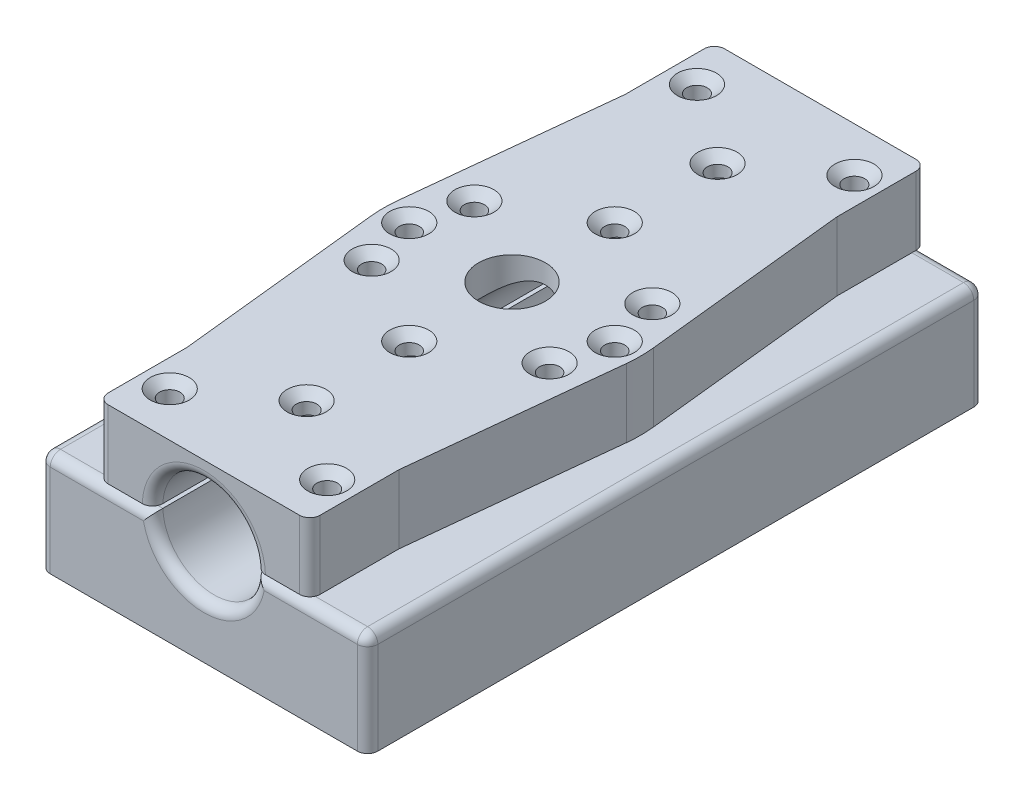
from build123d import *

# Parameters (mm, degrees)
BOSS_EXTRUDE2_DEPTH           = 76.2
BOSS_EXTRUDE2_2_DEPTH         = 76.2
BOSS_EXTRUDE3_START           = -76.2
BOSS_EXTRUDE3_DEPTH           = 76.2
BOSS_EXTRUDE4_START           = -16.9545
BOSS_EXTRUDE4_DEPTH           = 16.9545
SKETCH4_R                     = 8.255
CUT_EXTRUDE2_DEPTH            = 76.2
SKETCH6_R                     = 4.826
SKETCH6_R_2                   = 2.4892
CUT_EXTRUDE3_DEPTH            = 3.2258
CUT_EXTRUDE3_DRAFT            = -49
CUT_EXTRUDE3_PROFILE_2_DEPTH  = 3.2258
CUT_EXTRUDE3_PROFILE_2_DRAFT  = -49
CUT_EXTRUDE3_PROFILE_3_DEPTH  = 3.2258
CUT_EXTRUDE3_PROFILE_3_DRAFT  = -49
CUT_EXTRUDE3_PROFILE_4_DEPTH  = 3.2258
CUT_EXTRUDE3_PROFILE_4_DRAFT  = -49
CUT_EXTRUDE3_PROFILE_5_DEPTH  = 3.2258
CUT_EXTRUDE3_PROFILE_5_DRAFT  = -49
CUT_EXTRUDE3_PROFILE_6_DEPTH  = 3.2258
CUT_EXTRUDE3_PROFILE_6_DRAFT  = -49
CUT_EXTRUDE3_PROFILE_7_DEPTH  = 3.2258
CUT_EXTRUDE3_PROFILE_7_DRAFT  = -49
CUT_EXTRUDE3_PROFILE_8_DEPTH  = 3.2258
CUT_EXTRUDE3_PROFILE_8_DRAFT  = -49
CUT_EXTRUDE3_PROFILE_9_DEPTH  = 3.2258
CUT_EXTRUDE3_PROFILE_9_DRAFT  = -49
CUT_EXTRUDE3_PROFILE_10_DEPTH = 3.2258
CUT_EXTRUDE3_PROFILE_10_DRAFT = -49
CUT_EXTRUDE3_PROFILE_11_DEPTH = 3.2258
CUT_EXTRUDE3_PROFILE_11_DRAFT = -49
CUT_EXTRUDE3_PROFILE_12_DEPTH = 3.2258
CUT_EXTRUDE3_PROFILE_12_DRAFT = -49
CUT_EXTRUDE3_PROFILE_13_DEPTH = 3.2258
CUT_EXTRUDE3_PROFILE_13_DRAFT = -49
CUT_EXTRUDE3_PROFILE_14_DEPTH = 3.2258
CUT_EXTRUDE3_PROFILE_14_DRAFT = -49
CUT_EXTRUDE4_REACH            = 121.368
SKETCH6_3_R                   = 2.54
FILLET1_R                     = 2.54
FILLET2_R                     = 2.54


with BuildPart() as part:
    # Sketch1 → Boss-Extrude2 (new body)
    with BuildSketch(Plane.XY):
        with BuildLine():
            Line((-53.171085933, 25.4), (-81.001643606, 25.4))
            Line((-81.001643606, 25.4), (-81.001643606, 0))
            Line((-81.001643606, 0), (0, 0))
            Line((0, 0), (0, 25.4))
            Line((0, 25.4), (-27.791414067, 25.4))
            ThreePointArc((-27.791414067, 25.4), (-40.48125, 13.208), (-53.171085933, 25.4))
        make_face()
    extrude(amount=BOSS_EXTRUDE2_DEPTH)



with BuildPart() as body_2:
    # Sketch1 → Boss-Extrude2 2 (new body)
    with BuildSketch(Plane.XY):
        with BuildLine():
            Line((-66.675, 26.416), (-53.171085933, 26.416))
            ThreePointArc((-53.171085933, 26.416), (-40.48125, 38.608), (-27.791414067, 26.416))
            Line((-27.791414067, 26.416), (-14.2875, 26.416))
            Line((-14.2875, 26.416), (-14.2875, 43.3705))
            Line((-14.2875, 43.3705), (-66.675, 43.3705))
            Line((-66.675, 43.3705), (-66.675, 26.416))
        make_face()
    extrude(amount=BOSS_EXTRUDE2_2_DEPTH)


with BuildPart() as part_1:
    add(part.part)

    add(body_2.part)  # Boss-Extrude3 merges body 2
    # Sketch1<4> → Boss-Extrude3 (add)
    with BuildSketch(Plane.XY.offset(BOSS_EXTRUDE3_START)):
        with BuildLine():
            Line((-53.171085933, 25.4), (-81.001643606, 25.4))
            Line((-81.001643606, 25.4), (-81.001643606, 0))
            Line((-81.001643606, 0), (0, 0))
            Line((0, 0), (0, 25.4))
            Line((0, 25.4), (-27.791414067, 25.4))
            ThreePointArc((-27.791414067, 25.4), (-40.48125, 13.208), (-53.171085933, 25.4))
        make_face()
        with BuildLine():
            Line((-66.675, 26.416), (-53.171085933, 26.416))
            ThreePointArc((-53.171085933, 26.416), (-40.48125, 38.608), (-27.791414067, 26.416))
            Line((-27.791414067, 26.416), (-14.2875, 26.416))
            Line((-14.2875, 26.416), (-14.2875, 43.3705))
            Line((-14.2875, 43.3705), (-66.675, 43.3705))
            Line((-66.675, 43.3705), (-66.675, 26.416))
        make_face()
    extrude(amount=BOSS_EXTRUDE3_DEPTH)

    # Sketch5 → Boss-Extrude4 (add)
    with BuildSketch(Plane(origin=(0, 43.3705, 0), x_dir=(1, 0, 0), z_dir=(0, 1, 0)).offset(BOSS_EXTRUDE4_START)):
        with BuildLine():
            Line((-72.054699818, -3.343615792), (-66.675, -54.143615792))
            Line((-66.675, -54.143615792), (-66.675, 54.143615792))
            Line((-66.675, 54.143615792), (-72.054699818, 3.343615792))
            ThreePointArc((-72.054699818, 3.343615792), (-72.23125, 0), (-72.054699818, -3.343615792))
        make_face()
        with BuildLine():
            Line((-14.2875, -54.143615792), (-8.907800182, -3.343615792))
            ThreePointArc((-8.907800182, -3.343615792), (-8.73125, 0), (-8.907800182, 3.343615792))
            Line((-8.907800182, 3.343615792), (-14.2875, 54.143615792))
            Line((-14.2875, 54.143615792), (-14.2875, -54.143615792))
        make_face()
    extrude(amount=BOSS_EXTRUDE4_DEPTH)

    # Sketch4 → Cut-Extrude2 (cut)
    # profile 1 of 10: a face of its own
    with BuildSketch(Plane(origin=(0, 0, 0), x_dir=(-1, 0, 0), z_dir=(0, -1, 0))):
        with BuildLine():
            ThreePointArc((20.992976547, 12.7), (20.263906747, 14.4601302), (18.503776547, 15.1892))
            ThreePointArc((18.503776547, 15.1892), (16.045205154, 13.089285687), (17.734785181, 10.332560683))
            ThreePointArc((17.734785181, 10.332560683), (19.966982502, 10.686260947), (20.992976547, 12.7))
        make_face()
    # profile 2 of 10: a face of its own
    with BuildSketch(Plane(origin=(0, 0, 0), x_dir=(-1, 0, 0), z_dir=(0, -1, 0))):
        with BuildLine():
            ThreePointArc((17.590021803, 0), (16.860952003, 1.7601302), (15.100821803, 2.4892))
            ThreePointArc((15.100821803, 2.4892), (12.611621803, 0), (15.100821803, -2.4892))
            ThreePointArc((15.100821803, -2.4892), (16.860952003, -1.7601302), (17.590021803, 0))
        make_face()
    # profile 3 of 10: a face of its own
    with BuildSketch(Plane(origin=(0, 0, 0), x_dir=(-1, 0, 0), z_dir=(0, -1, 0))):
        with BuildLine():
            ThreePointArc((20.992976547, -12.7), (19.966982502, -10.686260947), (17.734785181, -10.332560683))
            ThreePointArc((17.734785181, -10.332560683), (16.348066112, -13.9446), (20.169543454, -14.549685717))
            ThreePointArc((20.169543454, -14.549685717), (20.777819601, -13.712346199), (20.992976547, -12.7))
        make_face()
    # profile 4 of 10: a face of its own
    with BuildSketch(Plane(origin=(0, 0, 0), x_dir=(-1, 0, 0), z_dir=(0, -1, 0))):
        with BuildLine():
            ThreePointArc((42.935580077, -24.8822464), (40.500821803, -22.9108), (38.06606353, -24.8822464))
            ThreePointArc((38.06606353, -24.8822464), (40.240517802, -27.875552154), (42.990021803, -25.4))
            ThreePointArc((42.990021803, -25.4), (42.976373957, -25.139695999), (42.935580077, -24.8822464))
        make_face()
    # profile 5 of 10: a face of its own
    with BuildSketch(Plane(origin=(0, 0, 0), x_dir=(-1, 0, 0), z_dir=(0, -1, 0))):
        with BuildLine():
            ThreePointArc((63.266858426, -10.332560683), (60.342156624, -11.4554), (60.832100152, -14.549685717))
            ThreePointArc((60.832100152, -14.549685717), (63.510213259, -14.974043054), (64.987067059, -12.7))
            ThreePointArc((64.987067059, -12.7), (64.511606113, -11.236794045), (63.266858426, -10.332560683))
        make_face()
    # profile 6 of 10: a face of its own
    with BuildSketch(Plane(origin=(0, 0, 0), x_dir=(-1, 0, 0), z_dir=(0, -1, 0))):
        with BuildLine():
            ThreePointArc((65.900821803, 2.4892), (63.411621803, 0), (65.900821803, -2.4892))
            ThreePointArc((65.900821803, -2.4892), (67.660952003, -1.7601302), (68.390021803, 0))
            ThreePointArc((68.390021803, 0), (67.660952003, 1.7601302), (65.900821803, 2.4892))
        make_face()
    # profile 7 of 10: a face of its own
    with BuildSketch(Plane(origin=(0, 0, 0), x_dir=(-1, 0, 0), z_dir=(0, -1, 0))):
        with BuildLine():
            ThreePointArc((62.497867059, 15.1892), (60.039295667, 12.310714313), (63.266858426, 10.332560683))
            ThreePointArc((63.266858426, 10.332560683), (64.511606113, 11.236794045), (64.987067059, 12.7))
            ThreePointArc((64.987067059, 12.7), (64.257997259, 14.4601302), (62.497867059, 15.1892))
        make_face()
    # profile 8 of 10: a face of its own
    with BuildSketch(Plane(origin=(0, 0, 0), x_dir=(-1, 0, 0), z_dir=(0, -1, 0))):
        with BuildLine():
            ThreePointArc((38.06606353, 24.8822464), (40.500821803, 22.9108), (42.935580077, 24.8822464))
            ThreePointArc((42.935580077, 24.8822464), (42.976373957, 25.139695999), (42.990021803, 25.4))
            ThreePointArc((42.990021803, 25.4), (42.260952003, 27.1601302), (40.500821803, 27.8892))
            ThreePointArc((40.500821803, 27.8892), (38.566279364, 26.966416991), (38.06606353, 24.8822464))
        make_face()
    # profile 9 of 10: a face of its own
    with BuildSketch(Plane(origin=(0, 0, 0), x_dir=(-1, 0, 0), z_dir=(0, -1, 0))):
        with Locations(Location((40.500821803, 0, 0), (0, 0, 90))):
            Circle(SKETCH4_R)
        Polygon((44.240319497, -6.477), (47.97981719, 0), (44.240319497, 6.477), (36.76132411, 6.477), (33.021826416, 0), (36.76132411, -6.477), align=None, mode=Mode.SUBTRACT)
    # profile 10 of 10: a face of its own
    with BuildSketch(Plane(origin=(0, 0, 0), x_dir=(-1, 0, 0), z_dir=(0, -1, 0))):
        Polygon((36.76132411, -6.477), (44.240319497, -6.477), (47.97981719, 0), (44.240319497, 6.477), (36.76132411, 6.477), (33.021826416, 0), align=None)
    extrude(amount=-CUT_EXTRUDE2_DEPTH, mode=Mode.SUBTRACT)


with BuildPart() as cut_extrude3_tool:
    # Sketch6 → Cut-Extrude3 (with draft: the straight prism first)
    with BuildSketch(Plane(origin=(0, 43.3705, 0), x_dir=(1, 0, 0), z_dir=(0, 1, 0))):
        with Locations((-62.497867059, 12.7)):
            Circle(SKETCH6_R)
        with Locations(Location((-62.497867059, 12.7, 0), (0, 0, 90))):
            Circle(SKETCH6_R_2, mode=Mode.SUBTRACT)
    extrude(amount=-CUT_EXTRUDE3_DEPTH)
    # Cut-Extrude3: the draft: its side faces are tilted about the plane it starts from
    cut_extrude3_sides = [cut_extrude3_tool.faces().sort_by_distance(p)[0] for p in [
        (-67.323867059, 41.7576, -12.7),
        (-62.497867059, 41.7576, -10.2108),
    ]]
    draft(cut_extrude3_sides, Plane(origin=(0, 43.3705, 0), x_dir=(1, 0, 0), z_dir=(0, 1, 0)), CUT_EXTRUDE3_DRAFT)


with BuildPart() as part_2:
    add(part_1.part)

    # Cut-Extrude3: cut by cut_extrude3_tool
    add(cut_extrude3_tool.part, mode=Mode.SUBTRACT)


with BuildPart() as cut_extrude3_profile_2_tool:
    # Sketch6 → Cut-Extrude3 profile 2 (with draft: the straight prism first)
    with BuildSketch(Plane(origin=(0, 43.3705, 0), x_dir=(1, 0, 0), z_dir=(0, 1, 0))):
        with Locations((-65.900821803, 0)):
            Circle(SKETCH6_R)
        with Locations(Location((-65.900821803, 0, 0), (0, 0, 90))):
            Circle(SKETCH6_R_2, mode=Mode.SUBTRACT)
    extrude(amount=-CUT_EXTRUDE3_PROFILE_2_DEPTH)
    # Cut-Extrude3 profile 2: the draft: its side faces are tilted about the plane it starts from
    cut_extrude3_profile_2_sides = [cut_extrude3_profile_2_tool.faces().sort_by_distance(p)[0] for p in [
        (-70.726821803, 41.7576, 0),
        (-65.900821803, 41.7576, 2.4892),
    ]]
    draft(cut_extrude3_profile_2_sides, Plane(origin=(0, 43.3705, 0), x_dir=(1, 0, 0), z_dir=(0, 1, 0)), CUT_EXTRUDE3_PROFILE_2_DRAFT)


with BuildPart() as part_3:
    add(part_2.part)

    # Cut-Extrude3 profile 2: cut by cut_extrude3_profile_2_tool
    add(cut_extrude3_profile_2_tool.part, mode=Mode.SUBTRACT)


with BuildPart() as cut_extrude3_profile_3_tool:
    # Sketch6 → Cut-Extrude3 profile 3 (with draft: the straight prism first)
    with BuildSketch(Plane(origin=(0, 43.3705, 0), x_dir=(1, 0, 0), z_dir=(0, 1, 0))):
        with Locations((-62.497867059, -12.7)):
            Circle(SKETCH6_R)
        with Locations(Location((-62.497867059, -12.7, 0), (0, 0, 90))):
            Circle(SKETCH6_R_2, mode=Mode.SUBTRACT)
    extrude(amount=-CUT_EXTRUDE3_PROFILE_3_DEPTH)
    # Cut-Extrude3 profile 3: the draft: its side faces are tilted about the plane it starts from
    cut_extrude3_profile_3_sides = [cut_extrude3_profile_3_tool.faces().sort_by_distance(p)[0] for p in [
        (-67.323867059, 41.7576, 12.7),
        (-62.497867059, 41.7576, 15.1892),
    ]]
    draft(cut_extrude3_profile_3_sides, Plane(origin=(0, 43.3705, 0), x_dir=(1, 0, 0), z_dir=(0, 1, 0)), CUT_EXTRUDE3_PROFILE_3_DRAFT)


with BuildPart() as part_4:
    add(part_3.part)

    # Cut-Extrude3 profile 3: cut by cut_extrude3_profile_3_tool
    add(cut_extrude3_profile_3_tool.part, mode=Mode.SUBTRACT)


with BuildPart() as cut_extrude3_profile_4_tool:
    # Sketch6 → Cut-Extrude3 profile 4 (with draft: the straight prism first)
    with BuildSketch(Plane(origin=(0, 43.3705, 0), x_dir=(1, 0, 0), z_dir=(0, 1, 0))):
        with Locations((-40.500821803, -25.4)):
            Circle(SKETCH6_R)
        with Locations(Location((-40.500821803, -25.4, 0), (0, 0, 90))):
            Circle(SKETCH6_R_2, mode=Mode.SUBTRACT)
    extrude(amount=-CUT_EXTRUDE3_PROFILE_4_DEPTH)
    # Cut-Extrude3 profile 4: the draft: its side faces are tilted about the plane it starts from
    cut_extrude3_profile_4_sides = [cut_extrude3_profile_4_tool.faces().sort_by_distance(p)[0] for p in [
        (-45.326821803, 41.7576, 25.4),
        (-40.500821803, 41.7576, 27.8892),
    ]]
    draft(cut_extrude3_profile_4_sides, Plane(origin=(0, 43.3705, 0), x_dir=(1, 0, 0), z_dir=(0, 1, 0)), CUT_EXTRUDE3_PROFILE_4_DRAFT)


with BuildPart() as part_5:
    add(part_4.part)

    # Cut-Extrude3 profile 4: cut by cut_extrude3_profile_4_tool
    add(cut_extrude3_profile_4_tool.part, mode=Mode.SUBTRACT)


with BuildPart() as cut_extrude3_profile_5_tool:
    # Sketch6 → Cut-Extrude3 profile 5 (with draft: the straight prism first)
    with BuildSketch(Plane(origin=(0, 43.3705, 0), x_dir=(1, 0, 0), z_dir=(0, 1, 0))):
        with Locations((-18.503776547, -12.7)):
            Circle(SKETCH6_R)
        with Locations(Location((-18.503776547, -12.7, 0), (0, 0, 90))):
            Circle(SKETCH6_R_2, mode=Mode.SUBTRACT)
    extrude(amount=-CUT_EXTRUDE3_PROFILE_5_DEPTH)
    # Cut-Extrude3 profile 5: the draft: its side faces are tilted about the plane it starts from
    cut_extrude3_profile_5_sides = [cut_extrude3_profile_5_tool.faces().sort_by_distance(p)[0] for p in [
        (-23.329776547, 41.7576, 12.7),
        (-18.503776547, 41.7576, 15.1892),
    ]]
    draft(cut_extrude3_profile_5_sides, Plane(origin=(0, 43.3705, 0), x_dir=(1, 0, 0), z_dir=(0, 1, 0)), CUT_EXTRUDE3_PROFILE_5_DRAFT)


with BuildPart() as part_6:
    add(part_5.part)

    # Cut-Extrude3 profile 5: cut by cut_extrude3_profile_5_tool
    add(cut_extrude3_profile_5_tool.part, mode=Mode.SUBTRACT)


with BuildPart() as cut_extrude3_profile_6_tool:
    # Sketch6 → Cut-Extrude3 profile 6 (with draft: the straight prism first)
    with BuildSketch(Plane(origin=(0, 43.3705, 0), x_dir=(1, 0, 0), z_dir=(0, 1, 0))):
        with Locations((-15.100821803, 0)):
            Circle(SKETCH6_R)
        with Locations(Location((-15.100821803, 0, 0), (0, 0, 90))):
            Circle(SKETCH6_R_2, mode=Mode.SUBTRACT)
    extrude(amount=-CUT_EXTRUDE3_PROFILE_6_DEPTH)
    # Cut-Extrude3 profile 6: the draft: its side faces are tilted about the plane it starts from
    cut_extrude3_profile_6_sides = [cut_extrude3_profile_6_tool.faces().sort_by_distance(p)[0] for p in [
        (-19.926821803, 41.7576, 0),
        (-15.100821803, 41.7576, 2.4892),
    ]]
    draft(cut_extrude3_profile_6_sides, Plane(origin=(0, 43.3705, 0), x_dir=(1, 0, 0), z_dir=(0, 1, 0)), CUT_EXTRUDE3_PROFILE_6_DRAFT)


with BuildPart() as part_7:
    add(part_6.part)

    # Cut-Extrude3 profile 6: cut by cut_extrude3_profile_6_tool
    add(cut_extrude3_profile_6_tool.part, mode=Mode.SUBTRACT)


with BuildPart() as cut_extrude3_profile_7_tool:
    # Sketch6 → Cut-Extrude3 profile 7 (with draft: the straight prism first)
    with BuildSketch(Plane(origin=(0, 43.3705, 0), x_dir=(1, 0, 0), z_dir=(0, 1, 0))):
        with Locations((-18.503776547, 12.7)):
            Circle(SKETCH6_R)
        with Locations(Location((-18.503776547, 12.7, 0), (0, 0, 90))):
            Circle(SKETCH6_R_2, mode=Mode.SUBTRACT)
    extrude(amount=-CUT_EXTRUDE3_PROFILE_7_DEPTH)
    # Cut-Extrude3 profile 7: the draft: its side faces are tilted about the plane it starts from
    cut_extrude3_profile_7_sides = [cut_extrude3_profile_7_tool.faces().sort_by_distance(p)[0] for p in [
        (-23.329776547, 41.7576, -12.7),
        (-18.503776547, 41.7576, -10.2108),
    ]]
    draft(cut_extrude3_profile_7_sides, Plane(origin=(0, 43.3705, 0), x_dir=(1, 0, 0), z_dir=(0, 1, 0)), CUT_EXTRUDE3_PROFILE_7_DRAFT)


with BuildPart() as part_8:
    add(part_7.part)

    # Cut-Extrude3 profile 7: cut by cut_extrude3_profile_7_tool
    add(cut_extrude3_profile_7_tool.part, mode=Mode.SUBTRACT)


with BuildPart() as cut_extrude3_profile_8_tool:
    # Sketch6 → Cut-Extrude3 profile 8 (with draft: the straight prism first)
    with BuildSketch(Plane(origin=(0, 43.3705, 0), x_dir=(1, 0, 0), z_dir=(0, 1, 0))):
        with Locations((-40.500821803, 25.4)):
            Circle(SKETCH6_R)
        with Locations(Location((-40.500821803, 25.4, 0), (0, 0, 90))):
            Circle(SKETCH6_R_2, mode=Mode.SUBTRACT)
    extrude(amount=-CUT_EXTRUDE3_PROFILE_8_DEPTH)
    # Cut-Extrude3 profile 8: the draft: its side faces are tilted about the plane it starts from
    cut_extrude3_profile_8_sides = [cut_extrude3_profile_8_tool.faces().sort_by_distance(p)[0] for p in [
        (-45.326821803, 41.7576, -25.4),
        (-40.500821803, 41.7576, -22.9108),
    ]]
    draft(cut_extrude3_profile_8_sides, Plane(origin=(0, 43.3705, 0), x_dir=(1, 0, 0), z_dir=(0, 1, 0)), CUT_EXTRUDE3_PROFILE_8_DRAFT)


with BuildPart() as part_9:
    add(part_8.part)

    # Cut-Extrude3 profile 8: cut by cut_extrude3_profile_8_tool
    add(cut_extrude3_profile_8_tool.part, mode=Mode.SUBTRACT)


with BuildPart() as cut_extrude3_profile_9_tool:
    # Sketch6 → Cut-Extrude3 profile 9 (with draft: the straight prism first)
    with BuildSketch(Plane(origin=(0, 43.3705, 0), x_dir=(1, 0, 0), z_dir=(0, 1, 0))):
        with Locations((-59.944, 65.171807896)):
            Circle(SKETCH6_R)
    extrude(amount=-CUT_EXTRUDE3_PROFILE_9_DEPTH)
    # Cut-Extrude3 profile 9: the draft: its side faces are tilted about the plane it starts from
    cut_extrude3_profile_9_sides = [cut_extrude3_profile_9_tool.faces().sort_by_distance(p)[0] for p in [
        (-64.77, 41.7576, -65.171807896),
    ]]
    draft(cut_extrude3_profile_9_sides, Plane(origin=(0, 43.3705, 0), x_dir=(1, 0, 0), z_dir=(0, 1, 0)), CUT_EXTRUDE3_PROFILE_9_DRAFT)


with BuildPart() as part_10:
    add(part_9.part)

    # Cut-Extrude3 profile 9: cut by cut_extrude3_profile_9_tool
    add(cut_extrude3_profile_9_tool.part, mode=Mode.SUBTRACT)


with BuildPart() as cut_extrude3_profile_10_tool:
    # Sketch6 → Cut-Extrude3 profile 10 (with draft: the straight prism first)
    with BuildSketch(Plane(origin=(0, 43.3705, 0), x_dir=(1, 0, 0), z_dir=(0, 1, 0))):
        with Locations((-21.0185, 65.171807896)):
            Circle(SKETCH6_R)
    extrude(amount=-CUT_EXTRUDE3_PROFILE_10_DEPTH)
    # Cut-Extrude3 profile 10: the draft: its side faces are tilted about the plane it starts from
    cut_extrude3_profile_10_sides = [cut_extrude3_profile_10_tool.faces().sort_by_distance(p)[0] for p in [
        (-25.8445, 41.7576, -65.171807896),
    ]]
    draft(cut_extrude3_profile_10_sides, Plane(origin=(0, 43.3705, 0), x_dir=(1, 0, 0), z_dir=(0, 1, 0)), CUT_EXTRUDE3_PROFILE_10_DRAFT)


with BuildPart() as part_11:
    add(part_10.part)

    # Cut-Extrude3 profile 10: cut by cut_extrude3_profile_10_tool
    add(cut_extrude3_profile_10_tool.part, mode=Mode.SUBTRACT)


with BuildPart() as cut_extrude3_profile_11_tool:
    # Sketch6 → Cut-Extrude3 profile 11 (with draft: the straight prism first)
    with BuildSketch(Plane(origin=(0, 43.3705, 0), x_dir=(1, 0, 0), z_dir=(0, 1, 0))):
        with Locations((-21.0185, -65.171807896)):
            Circle(SKETCH6_R)
    extrude(amount=-CUT_EXTRUDE3_PROFILE_11_DEPTH)
    # Cut-Extrude3 profile 11: the draft: its side faces are tilted about the plane it starts from
    cut_extrude3_profile_11_sides = [cut_extrude3_profile_11_tool.faces().sort_by_distance(p)[0] for p in [
        (-25.8445, 41.7576, 65.171807896),
    ]]
    draft(cut_extrude3_profile_11_sides, Plane(origin=(0, 43.3705, 0), x_dir=(1, 0, 0), z_dir=(0, 1, 0)), CUT_EXTRUDE3_PROFILE_11_DRAFT)


with BuildPart() as part_12:
    add(part_11.part)

    # Cut-Extrude3 profile 11: cut by cut_extrude3_profile_11_tool
    add(cut_extrude3_profile_11_tool.part, mode=Mode.SUBTRACT)


with BuildPart() as cut_extrude3_profile_12_tool:
    # Sketch6 → Cut-Extrude3 profile 12 (with draft: the straight prism first)
    with BuildSketch(Plane(origin=(0, 43.3705, 0), x_dir=(1, 0, 0), z_dir=(0, 1, 0))):
        with Locations((-59.944, -65.171807896)):
            Circle(SKETCH6_R)
    extrude(amount=-CUT_EXTRUDE3_PROFILE_12_DEPTH)
    # Cut-Extrude3 profile 12: the draft: its side faces are tilted about the plane it starts from
    cut_extrude3_profile_12_sides = [cut_extrude3_profile_12_tool.faces().sort_by_distance(p)[0] for p in [
        (-64.77, 41.7576, 65.171807896),
    ]]
    draft(cut_extrude3_profile_12_sides, Plane(origin=(0, 43.3705, 0), x_dir=(1, 0, 0), z_dir=(0, 1, 0)), CUT_EXTRUDE3_PROFILE_12_DRAFT)


with BuildPart() as part_13:
    add(part_12.part)

    # Cut-Extrude3 profile 12: cut by cut_extrude3_profile_12_tool
    add(cut_extrude3_profile_12_tool.part, mode=Mode.SUBTRACT)


with BuildPart() as cut_extrude3_profile_13_tool:
    # Sketch6 → Cut-Extrude3 profile 13 (with draft: the straight prism first)
    with BuildSketch(Plane(origin=(0, 43.3705, 0), x_dir=(1, 0, 0), z_dir=(0, 1, 0))):
        with Locations((-40.48125, 50.8)):
            Circle(SKETCH6_R)
    extrude(amount=-CUT_EXTRUDE3_PROFILE_13_DEPTH)
    # Cut-Extrude3 profile 13: the draft: its side faces are tilted about the plane it starts from
    cut_extrude3_profile_13_sides = [cut_extrude3_profile_13_tool.faces().sort_by_distance(p)[0] for p in [
        (-45.30725, 41.7576, -50.8),
    ]]
    draft(cut_extrude3_profile_13_sides, Plane(origin=(0, 43.3705, 0), x_dir=(1, 0, 0), z_dir=(0, 1, 0)), CUT_EXTRUDE3_PROFILE_13_DRAFT)


with BuildPart() as part_14:
    add(part_13.part)

    # Cut-Extrude3 profile 13: cut by cut_extrude3_profile_13_tool
    add(cut_extrude3_profile_13_tool.part, mode=Mode.SUBTRACT)


with BuildPart() as cut_extrude3_profile_14_tool:
    # Sketch6 → Cut-Extrude3 profile 14 (with draft: the straight prism first)
    with BuildSketch(Plane(origin=(0, 43.3705, 0), x_dir=(1, 0, 0), z_dir=(0, 1, 0))):
        with Locations((-40.48125, -50.8)):
            Circle(SKETCH6_R)
    extrude(amount=-CUT_EXTRUDE3_PROFILE_14_DEPTH)
    # Cut-Extrude3 profile 14: the draft: its side faces are tilted about the plane it starts from
    cut_extrude3_profile_14_sides = [cut_extrude3_profile_14_tool.faces().sort_by_distance(p)[0] for p in [
        (-45.30725, 41.7576, 50.8),
    ]]
    draft(cut_extrude3_profile_14_sides, Plane(origin=(0, 43.3705, 0), x_dir=(1, 0, 0), z_dir=(0, 1, 0)), CUT_EXTRUDE3_PROFILE_14_DRAFT)


with BuildPart() as part_15:
    add(part_14.part)

    # Cut-Extrude3 profile 14: cut by cut_extrude3_profile_14_tool
    add(cut_extrude3_profile_14_tool.part, mode=Mode.SUBTRACT)

    # Cut-Extrude4: up to this face of the body (flat: up to its plane)
    cut_extrude4_end = Plane(part_15.part.faces().sort_by_distance((-40.500821803, 0, 74.474108165))[0])
    # Sketch6<3> → Cut-Extrude4 (cut, up to the picked face)
    with BuildSketch(Plane(origin=(0, 43.3705, 0), x_dir=(1, 0, 0), z_dir=(0, 1, 0)), mode=Mode.PRIVATE) as cut_extrude4_sk1:
        with Locations(Location((-59.944, 65.171807896, 0), (0, 0, 270))):
            Circle(SKETCH6_3_R)
    cut_extrude4_tool1 = split(extrude(cut_extrude4_sk1.sketch, amount=-CUT_EXTRUDE4_REACH, mode=Mode.PRIVATE), bisect_by=cut_extrude4_end, keep=Keep.BOTH, mode=Mode.PRIVATE)
    # Sketch6<3> → Cut-Extrude4 (cut, up to the picked face)
    with BuildSketch(Plane(origin=(0, 43.3705, 0), x_dir=(1, 0, 0), z_dir=(0, 1, 0)), mode=Mode.PRIVATE) as cut_extrude4_sk2:
        with Locations(Location((-21.0185, 65.171807896, 0), (0, 0, 270))):
            Circle(SKETCH6_3_R)
    cut_extrude4_tool2 = split(extrude(cut_extrude4_sk2.sketch, amount=-CUT_EXTRUDE4_REACH, mode=Mode.PRIVATE), bisect_by=cut_extrude4_end, keep=Keep.BOTH, mode=Mode.PRIVATE)
    # Sketch6<3> → Cut-Extrude4 (cut, up to the picked face)
    with BuildSketch(Plane(origin=(0, 43.3705, 0), x_dir=(1, 0, 0), z_dir=(0, 1, 0)), mode=Mode.PRIVATE) as cut_extrude4_sk3:
        with Locations(Location((-21.0185, -65.171807896, 0), (0, 0, 270))):
            Circle(SKETCH6_3_R)
    cut_extrude4_tool3 = split(extrude(cut_extrude4_sk3.sketch, amount=-CUT_EXTRUDE4_REACH, mode=Mode.PRIVATE), bisect_by=cut_extrude4_end, keep=Keep.BOTH, mode=Mode.PRIVATE)
    # Sketch6<3> → Cut-Extrude4 (cut, up to the picked face)
    with BuildSketch(Plane(origin=(0, 43.3705, 0), x_dir=(1, 0, 0), z_dir=(0, 1, 0)), mode=Mode.PRIVATE) as cut_extrude4_sk4:
        with Locations(Location((-59.944, -65.171807896, 0), (0, 0, 270))):
            Circle(SKETCH6_3_R)
    cut_extrude4_tool4 = split(extrude(cut_extrude4_sk4.sketch, amount=-CUT_EXTRUDE4_REACH, mode=Mode.PRIVATE), bisect_by=cut_extrude4_end, keep=Keep.BOTH, mode=Mode.PRIVATE)
    # Sketch6<3> → Cut-Extrude4 (cut, up to the picked face)
    with BuildSketch(Plane(origin=(0, 43.3705, 0), x_dir=(1, 0, 0), z_dir=(0, 1, 0)), mode=Mode.PRIVATE) as cut_extrude4_sk5:
        with Locations(Location((-40.48125, 50.8, 0), (0, 0, 270))):
            Circle(SKETCH6_3_R)
    cut_extrude4_tool5 = split(extrude(cut_extrude4_sk5.sketch, amount=-CUT_EXTRUDE4_REACH, mode=Mode.PRIVATE), bisect_by=cut_extrude4_end, keep=Keep.BOTH, mode=Mode.PRIVATE)
    # Sketch6<3> → Cut-Extrude4 (cut, up to the picked face)
    with BuildSketch(Plane(origin=(0, 43.3705, 0), x_dir=(1, 0, 0), z_dir=(0, 1, 0)), mode=Mode.PRIVATE) as cut_extrude4_sk6:
        with Locations(Location((-40.48125, -50.8, 0), (0, 0, 270))):
            Circle(SKETCH6_3_R)
    cut_extrude4_tool6 = split(extrude(cut_extrude4_sk6.sketch, amount=-CUT_EXTRUDE4_REACH, mode=Mode.PRIVATE), bisect_by=cut_extrude4_end, keep=Keep.BOTH, mode=Mode.PRIVATE)
    add(cut_extrude4_tool1.solids().sort_by(Axis((-59.944, 43.3705, -65.171808), (0, -1, 0)))[0], mode=Mode.SUBTRACT)
    add(cut_extrude4_tool2.solids().sort_by(Axis((-21.0185, 43.3705, -65.171808), (0, -1, 0)))[0], mode=Mode.SUBTRACT)
    add(cut_extrude4_tool3.solids().sort_by(Axis((-21.0185, 43.3705, 65.171808), (0, -1, 0)))[0], mode=Mode.SUBTRACT)
    add(cut_extrude4_tool4.solids().sort_by(Axis((-59.944, 43.3705, 65.171808), (0, -1, 0)))[0], mode=Mode.SUBTRACT)
    add(cut_extrude4_tool5.solids().sort_by(Axis((-40.48125, 43.3705, -50.8), (0, -1, 0)))[0], mode=Mode.SUBTRACT)
    add(cut_extrude4_tool6.solids().sort_by(Axis((-40.48125, 43.3705, 50.8), (0, -1, 0)))[0], mode=Mode.SUBTRACT)

    # Fillet1
    fillet1_edges = [part_15.edges().sort_by_distance(p)[0] for p in [
        (-67.08636477, 25.4, 76.2),
        (0, 25.4, 0),
        (-81.001643606, 25.4, 0),
        (-81.001643606, 12.7, 76.2),
        (-81.001643606, 12.7, -76.2),
        (-40.48125, 13.208, -76.2),
        (-13.895707034, 25.4, -76.2),
        (0, 12.7, -76.2),
        (-67.08636477, 25.4, -76.2),
        (0, 12.7, 76.2),
        (-13.895707034, 25.4, 76.2),
        (-40.48125, 13.208, 76.2),
    ]]
    fillet(fillet1_edges, radius=FILLET1_R)

    # Fillet2
    fillet2_edges = [part_15.edges().sort_by_distance(p)[0] for p in [
        (-14.2875, 34.89325, 76.2),
        (-66.675, 34.89325, -76.2),
        (-40.48125, 38.608, -76.2),
        (-14.2875, 34.89325, -76.2),
        (-66.675, 34.89325, 76.2),
        (-40.48125, 38.608, 76.2),
    ]]
    fillet(fillet2_edges, radius=FILLET2_R)


solid = part_15.part
